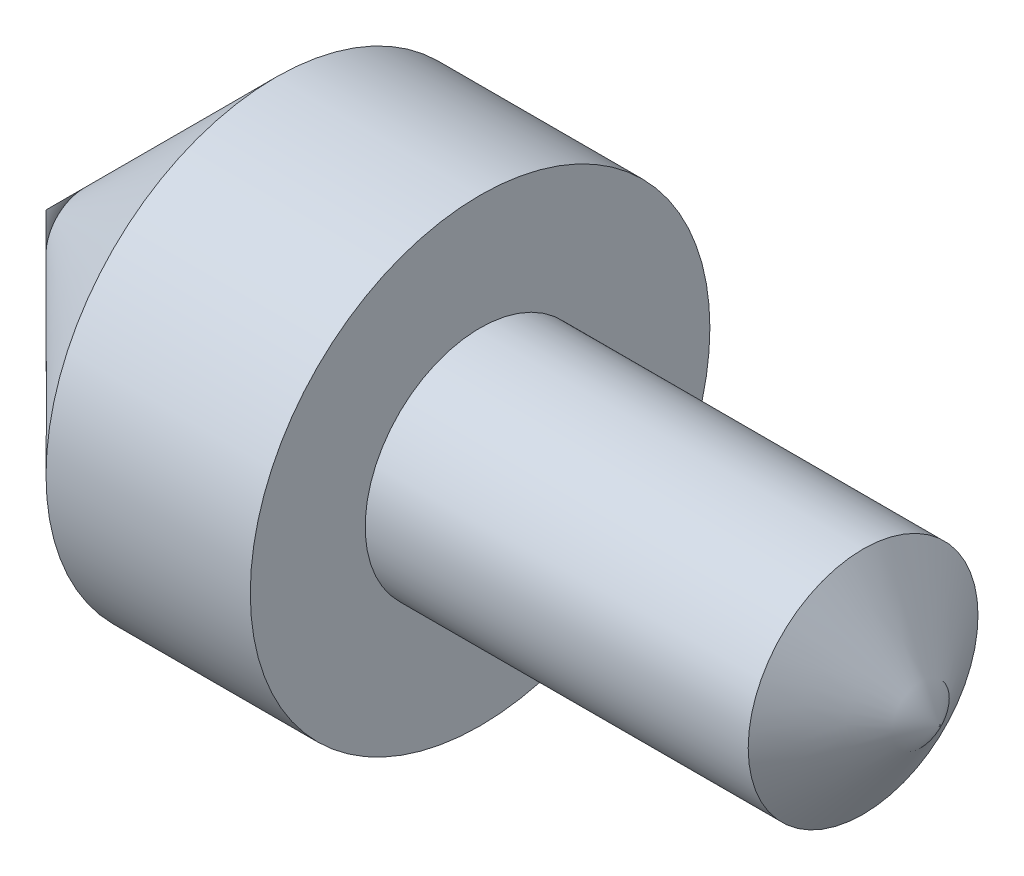
from build123d import *


with BuildPart() as part:
    # Esboço1 → Revolução1 (revolve)
    with BuildSketch(Plane.XY, mode=Mode.PRIVATE) as revolu_o1_sk:
        Polygon((0, 0), (-3, -4.5), (-18, -4.5), (-18, -9), (-26, -9), (-35, 0), align=None)
    revolve(revolu_o1_sk.sketch.rotate(Axis((0, 0, 0), (-1, 0, 0)), 270), axis=Axis((0, 0, 0), (-1, 0, 0)))


solid = part.part
